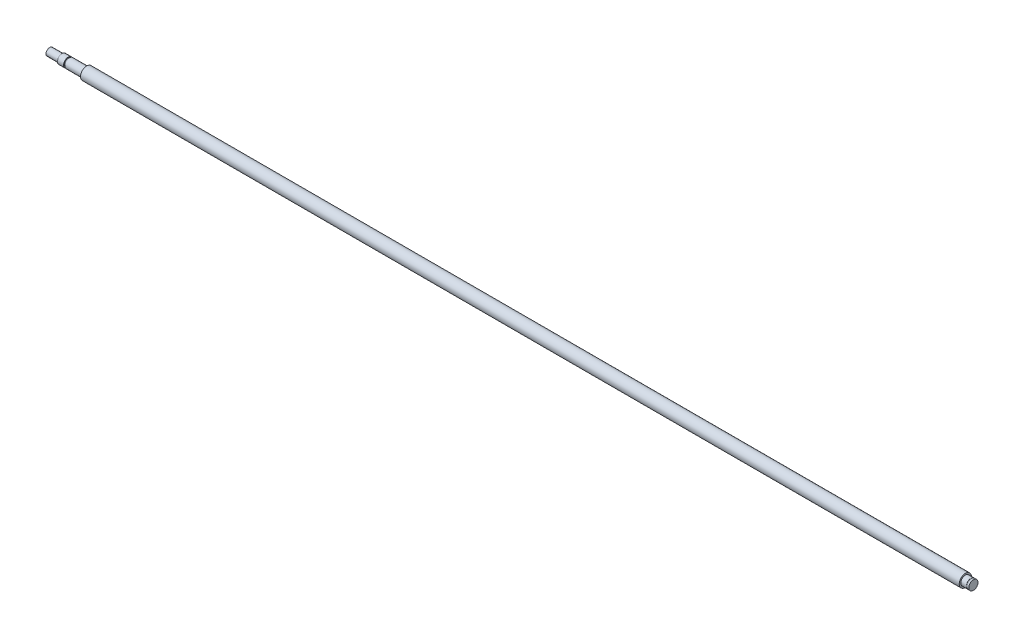
from build123d import *


with BuildPart() as part:
    # Sketch1 → Revolve1 (revolve)
    with BuildSketch(Plane.XY, mode=Mode.PRIVATE) as revolve1_sk:
        Polygon((-60, 0), (1440, 0), (1440, 7.5), (1437.15, 7.5), (1437.15, 7.15), (1436, 7.15), (1436, 7.5), (1427, 7.5), (1427, 10), (0, 10), (0, 7.5), (-28, 7.5), (-28, 6), (-30, 6), (-30, 7.5), (-40, 7.5), (-40, 6), (-60, 6), align=None)
    revolve(revolve1_sk.sketch.rotate(Axis((-60, 0, 0), (1, 0, 0)), 90), axis=Axis((-60, 0, 0), (1, 0, 0)))


solid = part.part
